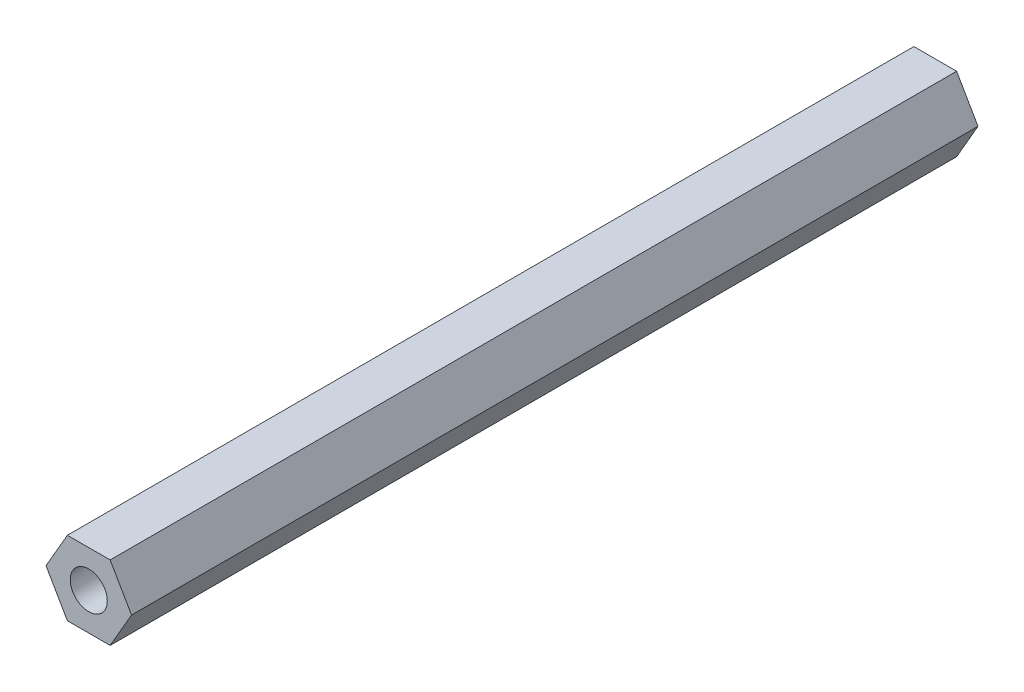
from build123d import *

# Parameters (mm, degrees)
EXTRUDE_F_DEPTH    = 80
SKETCH2_R          = 1.75
CUT_EXTRUDE1_DEPTH = 6.1
CUT_EXTRUDE2_START = -6.1
SKETCH3_R          = 1.75
CUT_EXTRUDE2_DEPTH = 6.1


with BuildPart() as part:
    # Sketch1 → Extrude f (new body)
    with BuildSketch(Plane.XY):
        Polygon((4.041451884, 0), (2.020725942, 3.5), (-2.020725942, 3.5), (-4.041451884, 0), (-2.020725942, -3.5), (2.020725942, -3.5), align=None)
    extrude(amount=EXTRUDE_F_DEPTH)

    # Sketch2 → Cut-Extrude1 (cut)
    with BuildSketch(Plane.XY.offset(80)):
        Circle(SKETCH2_R)
    extrude(amount=-CUT_EXTRUDE1_DEPTH, mode=Mode.SUBTRACT)

    # Sketch3 → Cut-Extrude2 (cut)
    with BuildSketch(Plane(origin=(0, 0, 0), x_dir=(-1, 0, 0), z_dir=(0, 0, -1)).offset(CUT_EXTRUDE2_START)):
        with Locations(Location((0, 0, 0), (0, 0, 180))):
            Circle(SKETCH3_R)
    extrude(amount=CUT_EXTRUDE2_DEPTH, mode=Mode.SUBTRACT)


solid = part.part
